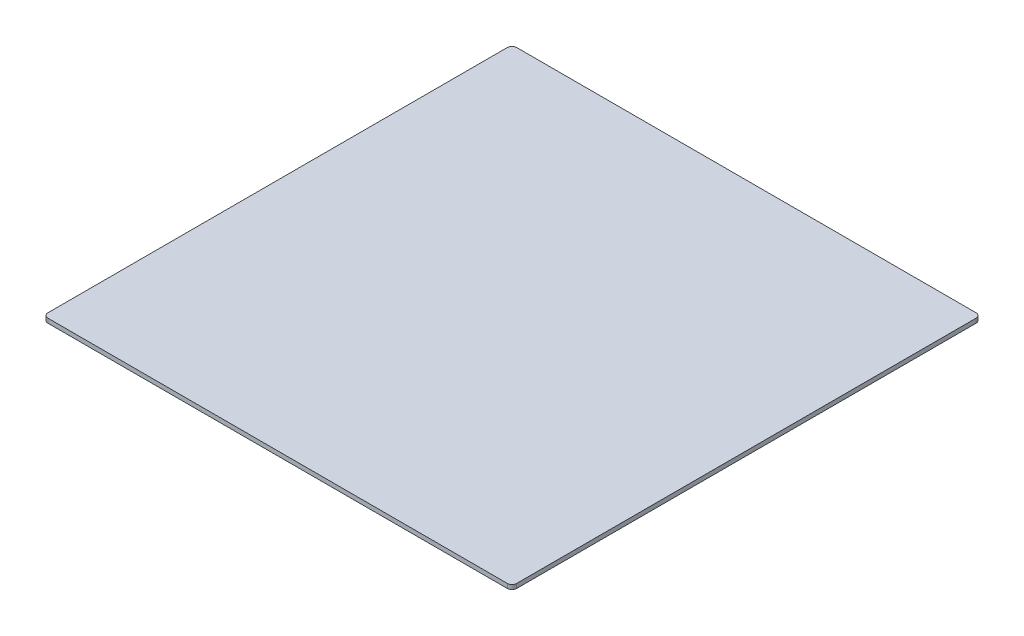
from build123d import *

# Parameters (mm, degrees)
SKETCH1_W           = 100
SKETCH1_H           = 100
BOSS_EXTRUDE1_DEPTH = 0.46865
FILLET1_R           = 1


with BuildPart() as part:
    # Sketch1 → Boss-Extrude1 (new, symmetric)
    with BuildSketch(Plane(origin=(0, 0, 0), x_dir=(1, 0, 0), z_dir=(0, 1, 0))):
        Rectangle(SKETCH1_W, SKETCH1_H)
    extrude(amount=BOSS_EXTRUDE1_DEPTH, both=True)

    # Fillet1
    fillet1_edges = [part.edges().sort_by_distance(p)[0] for p in [
        (50, 0, 50),
        (-50, 0, 50),
        (-50, 0, -50),
        (50, 0, -50),
    ]]
    fillet(fillet1_edges, radius=FILLET1_R)


solid = part.part
